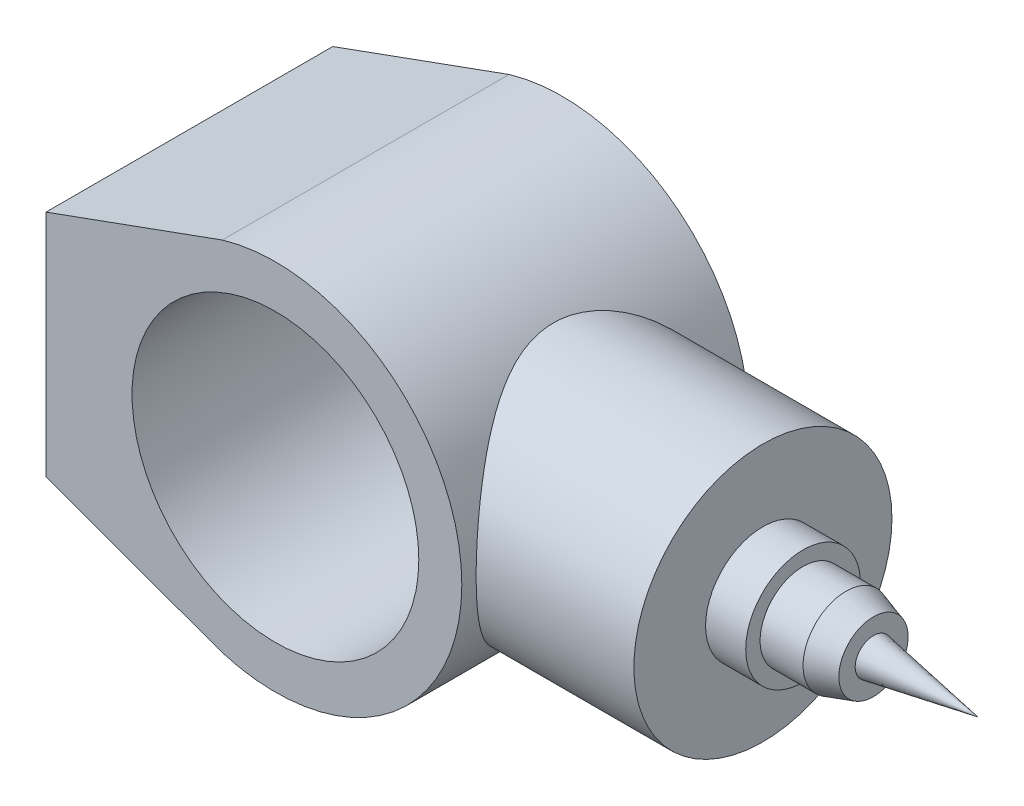
from build123d import *

# Parameters (mm, degrees)
SKETCH1_R                = 50
BOSS_EXTRUDE1_DEPTH      = 50
BOSS_EXTRUDE2_REACH      = 218.16
BOSS_EXTRUDE2_END_RADIUS = 65
SKETCH2_R                = 45


with BuildPart() as part:
    # Sketch1 → Boss-Extrude1 (new, symmetric)
    with BuildSketch(Plane.XY):
        with BuildLine():
            Line((-80, -40), (-80, 40))
            Line((-80, 40), (-18.511855165, 62.308195435))
            ThreePointArc((-18.511855165, 62.308195435), (65, 0), (-18.511855165, -62.308195435))
            Line((-18.511855165, -62.308195435), (-80, -40))
        make_face()
        Circle(SKETCH1_R, mode=Mode.SUBTRACT)
    extrude(amount=BOSS_EXTRUDE1_DEPTH, both=True)

    # Boss-Extrude2: up to this cylinder (the profile starts outside it)
    boss_extrude2_end = Plane(origin=(0, 0, 0), z_dir=(0, 0, -1)) * Cylinder(BOSS_EXTRUDE2_END_RADIUS, 567.32, mode=Mode.PRIVATE)
    # Sketch2 → Boss-Extrude2 (add, up to the surface)
    with BuildSketch(Plane(origin=(120, 0, 0), x_dir=(0, 0, -1), z_dir=(1, 0, 0)), mode=Mode.PRIVATE) as boss_extrude2_sk1:
        Circle(SKETCH2_R)
    boss_extrude2_tool1 = extrude(boss_extrude2_sk1.sketch, amount=-BOSS_EXTRUDE2_REACH, mode=Mode.PRIVATE) - boss_extrude2_end
    add(boss_extrude2_tool1.solids().sort_by_distance((120, 0, 0))[0])

    # Sketch3 → Revolve1 (revolve)
    with BuildSketch(Plane.XY, mode=Mode.PRIVATE) as revolve1_sk:
        Polygon((120, 0), (120, -20), (134, -20), (134, -15), (149, -15), (149, -15.022227685), (158.555535821, -12.074052797), (158.555535821, -6.387568451), (195, 0), align=None)
    revolve(revolve1_sk.sketch.rotate(Axis((0, 0, 0), (1, 0, 0)), 270), axis=Axis((0, 0, 0), (1, 0, 0)))


solid = part.part
